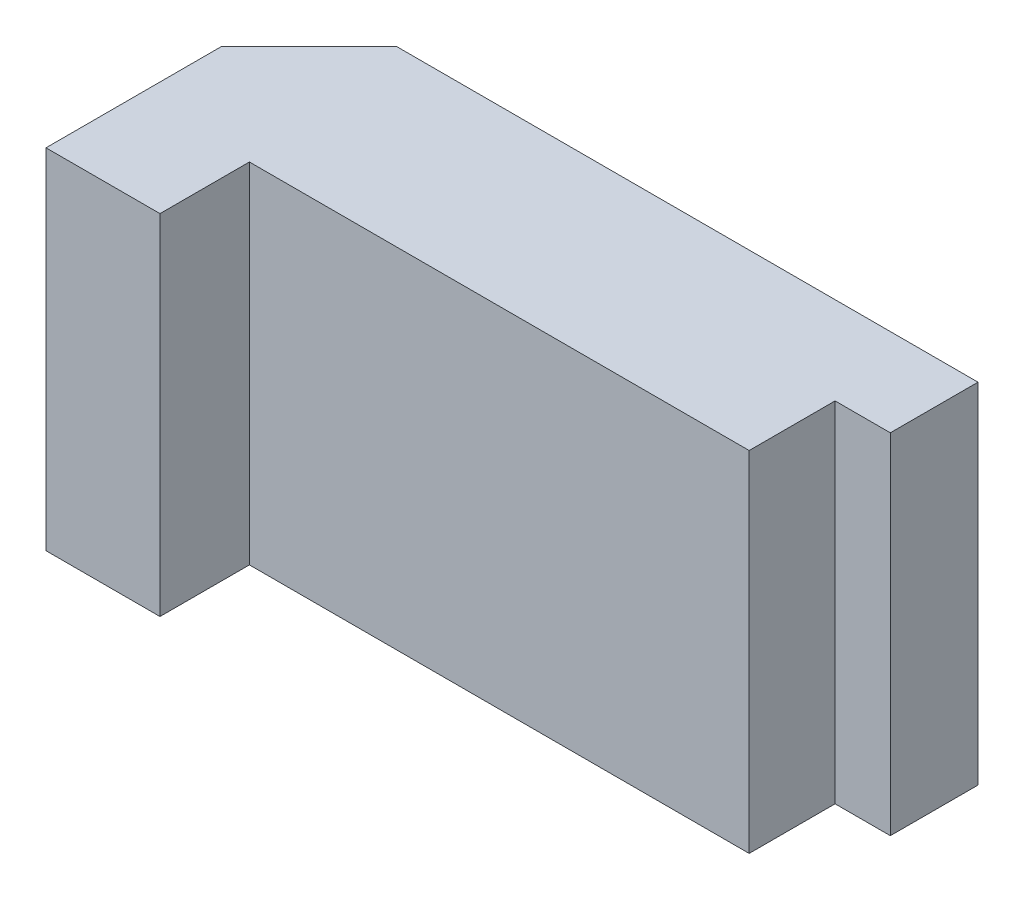
from build123d import *

# Parameters (mm, degrees)
BOSS_EXTRUDE1_DEPTH = 19.9


with BuildPart() as part:
    # Sketch1 → Boss-Extrude1 (new, symmetric)
    with BuildSketch(Plane(origin=(0, 0, 0), x_dir=(1, 0, 0), z_dir=(0, 1, 0))):
        Polygon((0, 0), (0, 20), (10, 30), (76.3, 30), (76.3, 20), (70, 20), (70, 10.2), (13, 10.2), (13, 0), align=None)
    extrude(amount=BOSS_EXTRUDE1_DEPTH, both=True)


solid = part.part
